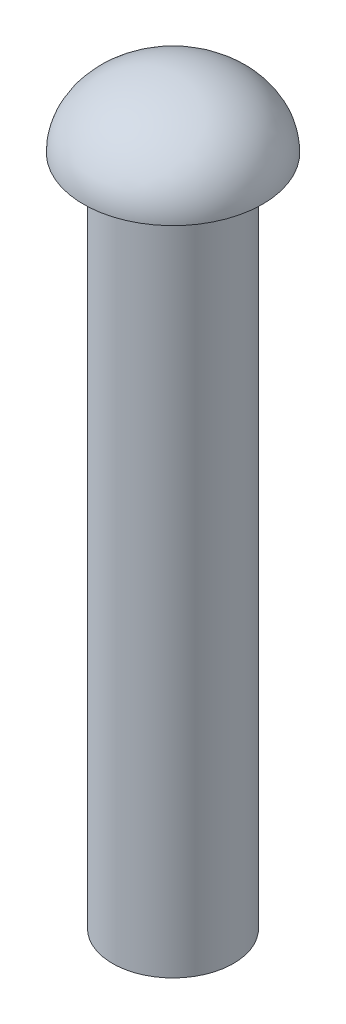
from build123d import *

# Parameters (mm, degrees)
SKETCH1_R           = 1.3716
BOSS_EXTRUDE1_DEPTH = 15.24


with BuildPart() as part:
    # Sketch1 → Boss-Extrude1 (new body)
    with BuildSketch(Plane(origin=(0, 0, 0), x_dir=(1, 0, 0), z_dir=(0, 1, 0))):
        with Locations(Location((0, 0, 0), (0, 0, 90))):
            Circle(SKETCH1_R)
    extrude(amount=BOSS_EXTRUDE1_DEPTH)

    # Sketch2 → Revolve1 (revolve)
    with BuildSketch(Plane(origin=(0, 0, 0), x_dir=(-1, 0, 0), z_dir=(0, 0, -1))):
        with BuildLine():
            add(Edge.make_bspline(
                [(0, 16.764), (-2.032, 16.764), (-2.032, 15.24)],
                knots=[4.71238898, 4.71238898, 4.71238898, 6.283185307, 6.283185307, 6.283185307], degree=2, weights=[1, 0.707106781, 1]))
            Line((-2.032, 15.24), (0, 15.24))
            Line((0, 15.24), (0, 16.764))
        make_face()
    revolve(axis=Axis((0, 15.24, 0), (0, 1, 0)))


solid = part.part
